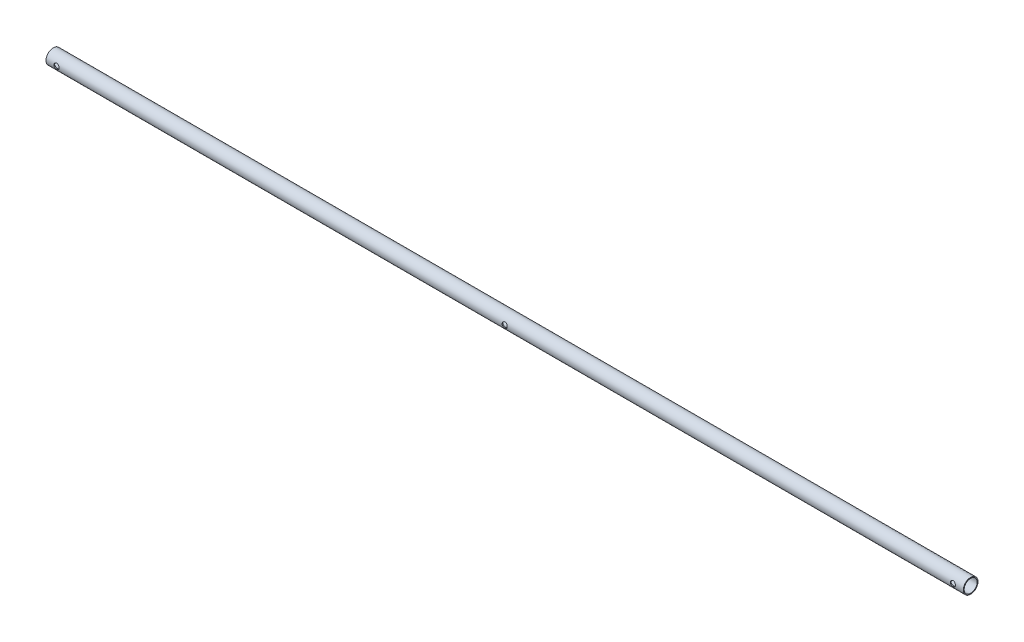
from build123d import *

# Parameters (mm, degrees)
SKETCH1_R               = 8.9662
SKETCH1_R_2             = 7.8994
BOSS_EXTRUDE1_DEPTH     = 1117.6
CUT_EXTRUDE1_DEPTH      = 1118.671931062
CUT_EXTRUDE1_DEPTH_BACK = 1118.671931062
SKETCH2_R               = 3.175


with BuildPart() as part:
    # Sketch1 → Boss-Extrude1 (new body)
    with BuildSketch(Plane(origin=(0, 0, 0), x_dir=(0, 0, -1), z_dir=(1, 0, 0))):
        Circle(SKETCH1_R)
        Circle(SKETCH1_R_2, mode=Mode.SUBTRACT)
    extrude(amount=BOSS_EXTRUDE1_DEPTH)

    # Sketch2 → Cut-Extrude1 (cut, two sides: drawn at the far end of the back side and taken through both)
    with BuildSketch(Plane.XY.offset(-CUT_EXTRUDE1_DEPTH_BACK)):
        with Locations((558.8, 0)):
            Circle(SKETCH2_R)
        with Locations((12.7, 0)):
            Circle(SKETCH2_R)
        with Locations((1104.9, 0)):
            Circle(SKETCH2_R)
    extrude(amount=CUT_EXTRUDE1_DEPTH + CUT_EXTRUDE1_DEPTH_BACK, mode=Mode.SUBTRACT)


solid = part.part
